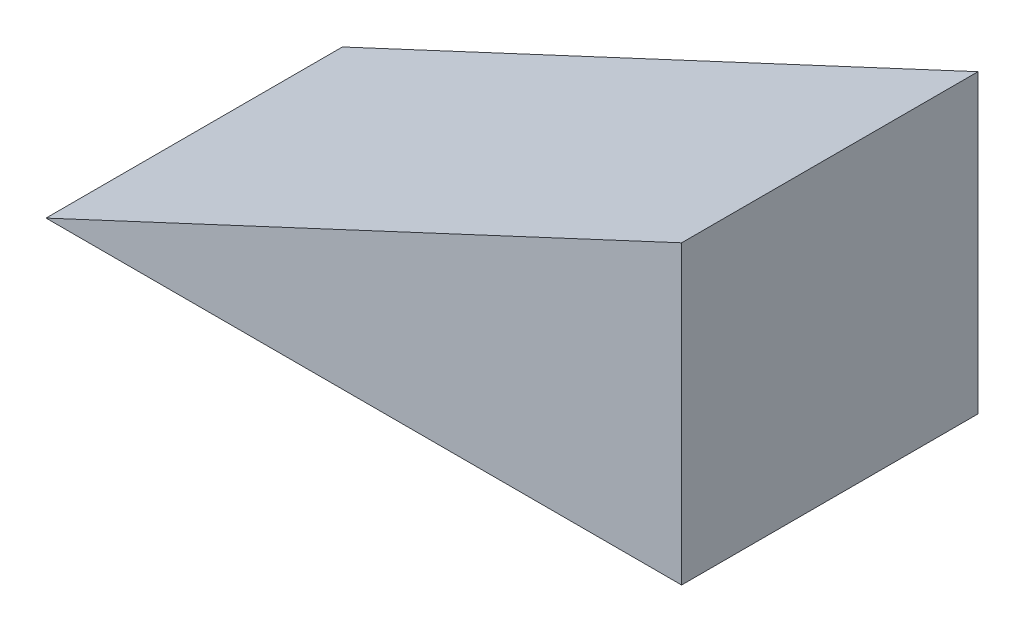
from build123d import *

# Parameters (mm, degrees)
Y_KSEKLIK_EKSTR_ZYON1_DEPTH = 20


with BuildPart() as part:
    # Çizim1 → Yükseklik-Ekstrüzyon1 (new body)
    with BuildSketch(Plane.XY):
        Polygon((-7.606325652, 3.149757742), (35.283812758, 23.149757742), (35.283812758, 3.149757742), align=None)
    extrude(amount=Y_KSEKLIK_EKSTR_ZYON1_DEPTH)


solid = part.part
